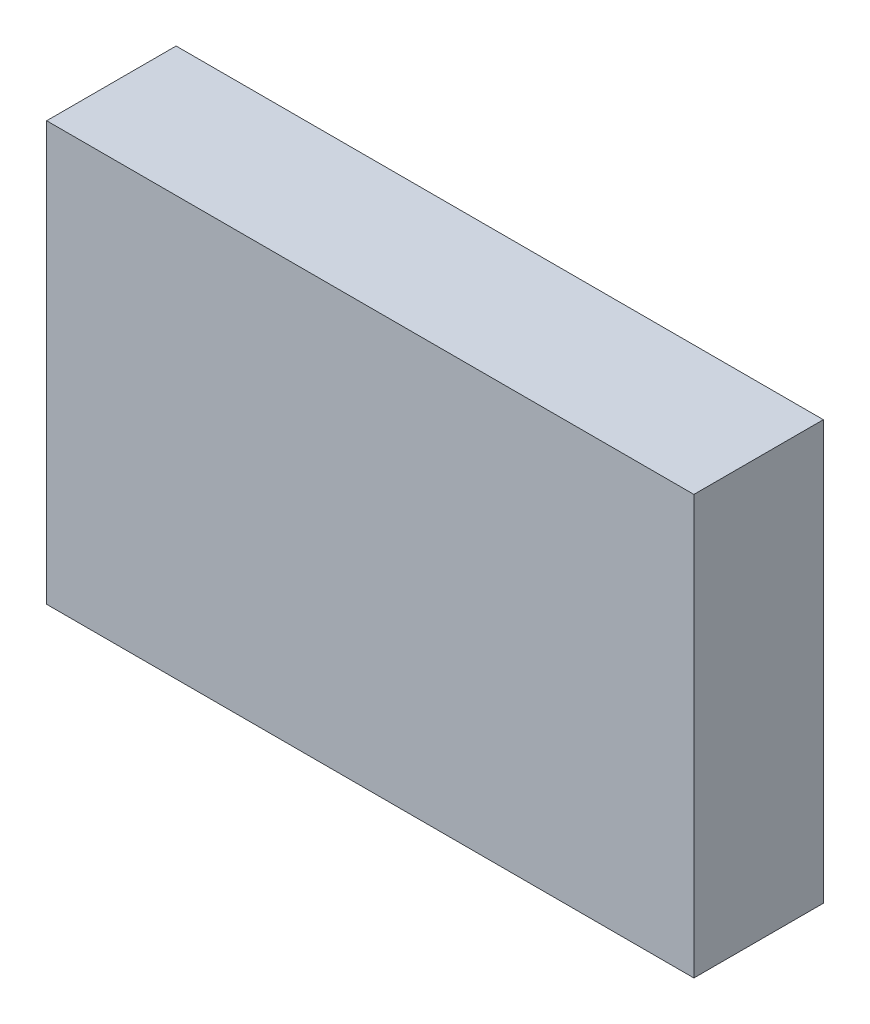
from build123d import *

# Parameters (mm, degrees)
SKETCH1_W           = 85
SKETCH1_H           = 55
BOSS_EXTRUDE1_DEPTH = 17


with BuildPart() as part:
    # Sketch1 → Boss-Extrude1 (new body)
    with BuildSketch(Plane.XY):
        with Locations((4.215808716, -1.910566661)):
            Rectangle(SKETCH1_W, SKETCH1_H)
    extrude(amount=BOSS_EXTRUDE1_DEPTH)


solid = part.part
